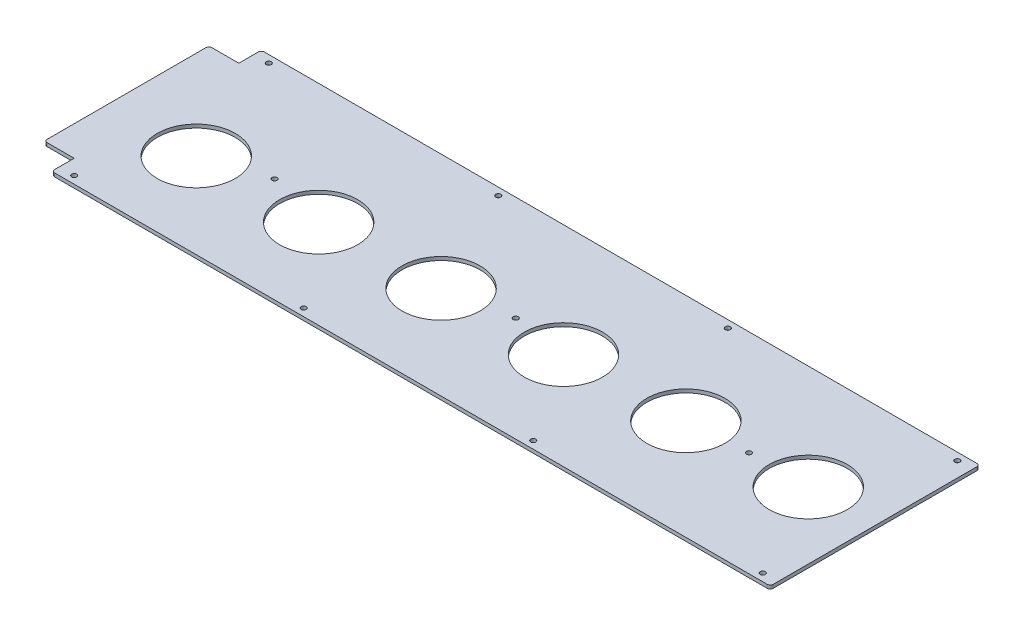
from build123d import *

# Parameters (mm, degrees)
SKETCH1_R             = 33.147
BOSS_EXTRUDE1_DEPTH   = 2.9718
F_8_CLEARANCE_HOLE1_D = 4.3053
FILLET1_R             = 2.54


with BuildPart() as part:
    # Sketch1 → Boss-Extrude1 (new body)
    with BuildSketch(Plane(origin=(0, 0, 0), x_dir=(1, 0, 0), z_dir=(0, 1, 0))):
        Polygon((720.939652548, 26.242162499), (720.939652548, -113.457837501), (746.339652548, -113.457837501), (746.339652548, -132.507837501), (1355.939652548, -132.507837501), (1355.939652548, 45.292162499), (746.339652548, 45.292162499), (746.339652548, 26.242162499), align=None)
        with Locations(Location((1299.335652548, -43.607837501, 0), (0, 0, 270))):
            Circle(SKETCH1_R, mode=Mode.SUBTRACT)
        with Locations(Location((1198.753990482, -46.877734612, 0), (0, 0, 270))):
            Circle(SKETCH1_R, mode=Mode.SUBTRACT)
        with Locations(Location((1098.172328416, -50.147631723, 0), (0, 0, 270))):
            Circle(SKETCH1_R, mode=Mode.SUBTRACT)
        with Locations(Location((997.59066635, -53.417528834, 0), (0, 0, 270))):
            Circle(SKETCH1_R, mode=Mode.SUBTRACT)
        with Locations(Location((897.009004284, -56.687425945, 0), (0, 0, 270))):
            Circle(SKETCH1_R, mode=Mode.SUBTRACT)
        with Locations(Location((796.427342219, -59.957323056, 0), (0, 0, 270))):
            Circle(SKETCH1_R, mode=Mode.SUBTRACT)
    extrude(amount=BOSS_EXTRUDE1_DEPTH)

    # #8 Clearance Hole1 (through all)
    with Locations(Plane(origin=(0, 2.9718, 0), x_dir=(1, 0, 0), z_dir=(0, 1, 0))):
        with Locations((759.039652548, 38.942162499), (759.039652548, -126.157837501), (953.772985881, -126.157837501), (953.772985881, 38.942162499), (1148.506319214, 38.942162499), (1148.506319214, -126.157837501), (1343.239652548, -126.157837501), (1343.239652548, 38.942162499), (1249.018252548, -43.607837501), (1051.139652548, -43.607837501), (846.479052548, -43.607837501)):
            Hole(F_8_CLEARANCE_HOLE1_D / 2)

    # Fillet1
    fillet1_edges = [part.edges().sort_by_distance(p)[0] for p in [
        (746.339652548, 1.4859, 132.507837501),
        (720.939652548, 1.4859, 113.457837501),
        (720.939652548, 1.4859, -26.242162499),
        (746.339652548, 1.4859, -45.292162499),
        (1355.939652548, 1.4859, -45.292162499),
        (1355.939652548, 1.4859, 132.507837501),
    ]]
    fillet(fillet1_edges, radius=FILLET1_R)


solid = part.part
